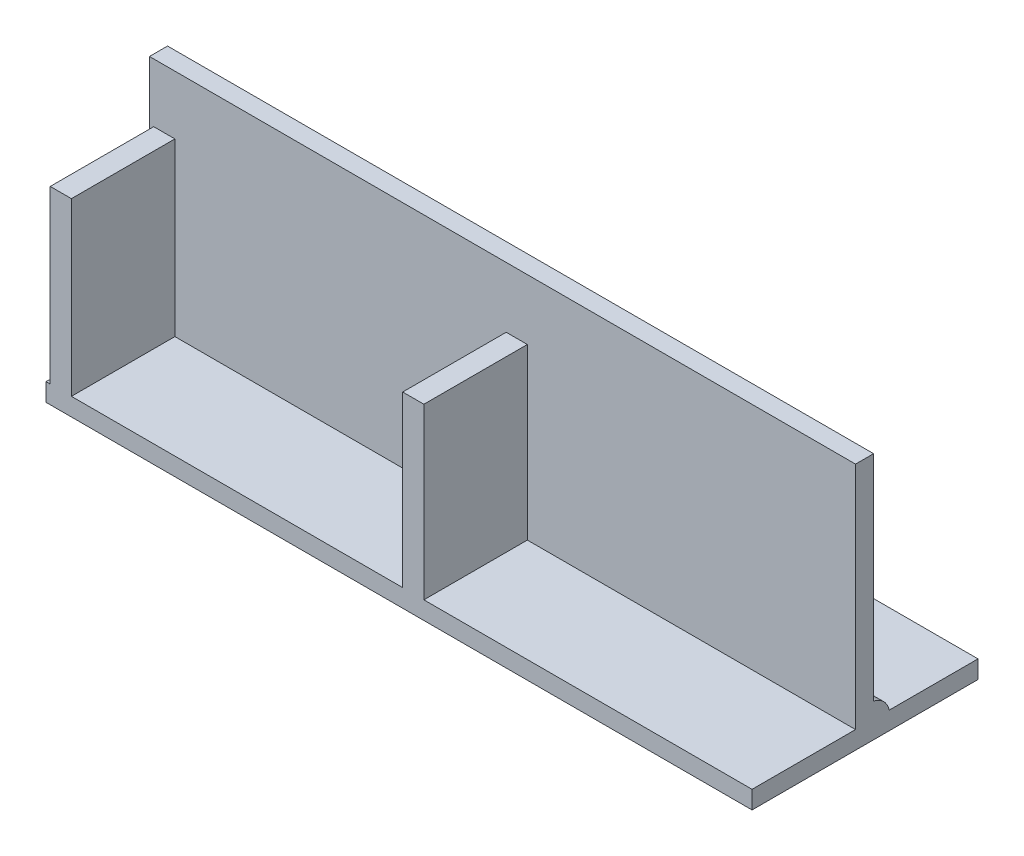
from build123d import *

# Parameters (mm, degrees)
SKETCH1_W           = 317.5
SKETCH1_H           = 101.6
BOSS_EXTRUDE1_DEPTH = 8.0518
BOSS_EXTRUDE2_START = 8.0518
SKETCH2_W           = 317.5
SKETCH2_H           = 8.128
BOSS_EXTRUDE2_DEPTH = 103.378
BOSS_EXTRUDE3_START = 8.0518
SKETCH3_W           = 9.525
SKETCH3_H           = 46.5328
BOSS_EXTRUDE3_DEPTH = 76.9874
BOSS_EXTRUDE4_START = 8.0518
SKETCH3_3_W         = 9.525
SKETCH3_3_H         = 46.5328
BOSS_EXTRUDE4_DEPTH = 76.1746
BOSS_EXTRUDE5_DEPTH = 317.5


with BuildPart() as part:
    # Sketch1 → Boss-Extrude1 (new body)
    with BuildSketch(Plane(origin=(0, 0, 0), x_dir=(1, 0, 0), z_dir=(0, 1, 0))):
        with Locations((158.75, 50.8)):
            Rectangle(SKETCH1_W, SKETCH1_H)
    extrude(amount=BOSS_EXTRUDE1_DEPTH)

    # Sketch2 → Boss-Extrude2 (add)
    with BuildSketch(Plane(origin=(0, 0, 0), x_dir=(1, 0, 0), z_dir=(0, 1, 0)).offset(BOSS_EXTRUDE2_START)):
        with Locations((158.75, 50.5968)):
            Rectangle(SKETCH2_W, SKETCH2_H)
    extrude(amount=BOSS_EXTRUDE2_DEPTH)

    # Sketch3 → Boss-Extrude3 (add)
    with BuildSketch(Plane(origin=(0, 0, 0), x_dir=(1, 0, 0), z_dir=(0, 1, 0)).offset(BOSS_EXTRUDE3_START)):
        with Locations((6.6675, 23.2664)):
            Rectangle(SKETCH3_W, SKETCH3_H)
    extrude(amount=BOSS_EXTRUDE3_DEPTH)

    # Sketch3<3> → Boss-Extrude4 (add)
    with BuildSketch(Plane(origin=(0, 0, 0), x_dir=(1, 0, 0), z_dir=(0, 1, 0)).offset(BOSS_EXTRUDE4_START)):
        with Locations((165.1635, 23.2664)):
            Rectangle(SKETCH3_3_W, SKETCH3_3_H)
    extrude(amount=BOSS_EXTRUDE4_DEPTH)

    # Sketch4 → Boss-Extrude5 (add)
    with BuildSketch(Plane(origin=(0, 0, 0), x_dir=(0, 0, -1), z_dir=(1, 0, 0))):
        with BuildLine():
            Line((61.6458, 8.0518), (54.6608, 8.0518))
            Line((54.6608, 8.0518), (54.6608, 15.0368))
            ThreePointArc((54.6608, 15.0368), (59.20078128, 12.59178128), (61.6458, 8.0518))
        make_face()
    extrude(amount=BOSS_EXTRUDE5_DEPTH)


solid = part.part
